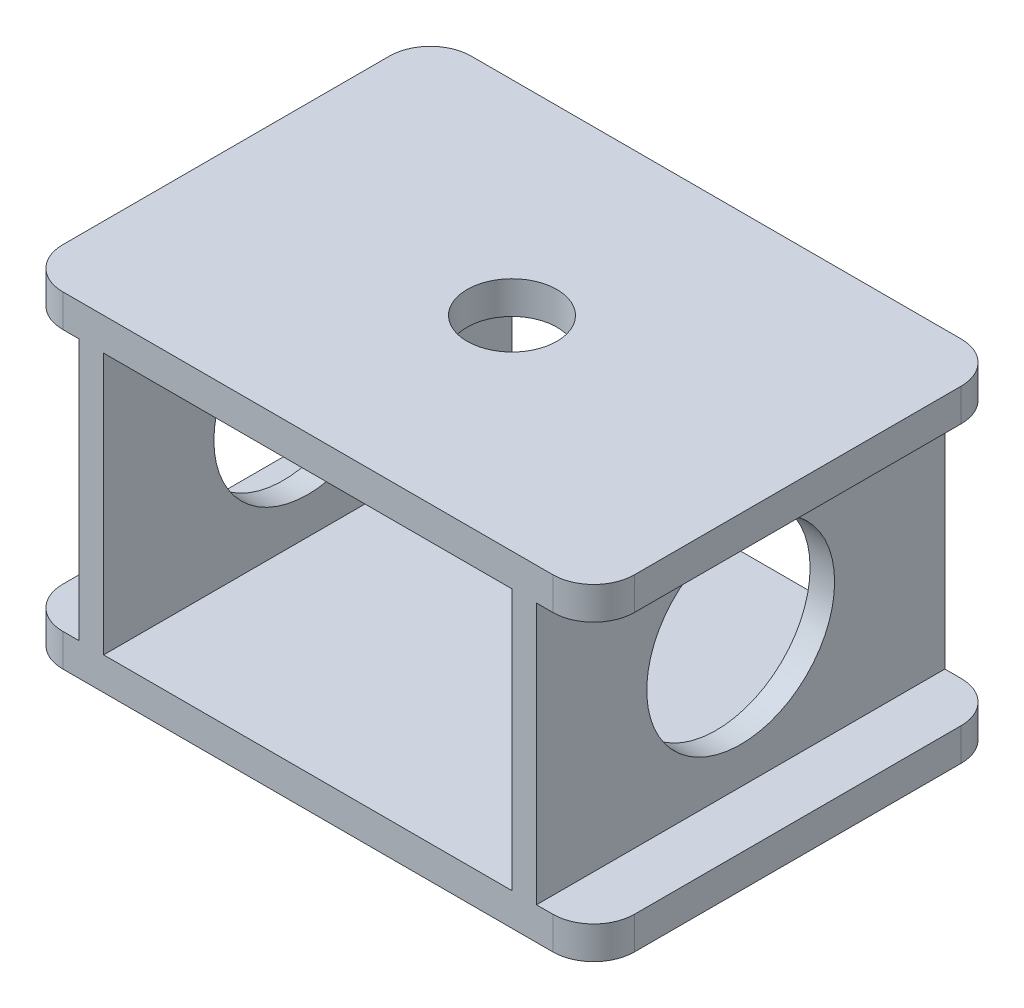
from build123d import *

# Parameters (mm, degrees)
BOSS_EXTRUDE1_DEPTH = 4
SKETCH2_W           = 3
SKETCH2_H           = 50
BOSS_EXTRUDE2_DEPTH = 32
BOSS_EXTRUDE3_DEPTH = 4
SKETCH4_R           = 11.5
CUT_EXTRUDE1_DEPTH  = 79.70196948
CUT_EXTRUDE2_REACH  = 60.737
SKETCH5_R           = 5.5


with BuildPart() as part:
    # Sketch1 → Boss-Extrude1 (new body)
    with BuildSketch(Plane(origin=(0, 0, 0), x_dir=(1, 0, 0), z_dir=(0, 1, 0))):
        with BuildLine():
            Line((-30, 25), (30, 25))
            ThreePointArc((30, 25), (33.535533906, 23.535533906), (35, 20))
            Line((35, 20), (35, -20))
            ThreePointArc((35, -20), (33.535533906, -23.535533906), (30, -25))
            Line((30, -25), (-30, -25))
            ThreePointArc((-30, -25), (-33.535533906, -23.535533906), (-35, -20))
            Line((-35, -20), (-35, 20))
            ThreePointArc((-35, 20), (-33.535533906, 23.535533906), (-30, 25))
        make_face()
    extrude(amount=BOSS_EXTRUDE1_DEPTH)

    # Sketch2 → Boss-Extrude2 (add)
    with BuildSketch(Plane(origin=(0, 4, 0), x_dir=(1, 0, 0), z_dir=(0, 1, 0))):
        with Locations((-26.5, 0)):
            Rectangle(SKETCH2_W, SKETCH2_H)
        with Locations((26.5, 0)):
            Rectangle(SKETCH2_W, SKETCH2_H)
    extrude(amount=BOSS_EXTRUDE2_DEPTH)

    # Sketch3 → Boss-Extrude3 (add)
    with BuildSketch(Plane(origin=(0, 36, 0), x_dir=(1, 0, 0), z_dir=(0, 1, 0))):
        with BuildLine():
            Line((28, -25), (30, -25))
            ThreePointArc((30, -25), (33.535533906, -23.535533906), (35, -20))
            Line((35, -20), (35, 20))
            ThreePointArc((35, 20), (33.535533906, 23.535533906), (30, 25))
            Line((30, 25), (28, 25))
            Line((28, 25), (25, 25))
            Line((25, 25), (-25, 25))
            Line((-25, 25), (-28, 25))
            Line((-28, 25), (-30, 25))
            ThreePointArc((-30, 25), (-33.535533906, 23.535533906), (-35, 20))
            Line((-35, 20), (-35, -20))
            ThreePointArc((-35, -20), (-33.535533906, -23.535533906), (-30, -25))
            Line((-30, -25), (-28, -25))
            Line((-28, -25), (-25, -25))
            Line((-25, -25), (25, -25))
            Line((25, -25), (28, -25))
        make_face()
    extrude(amount=BOSS_EXTRUDE3_DEPTH)

    # Sketch4 → Cut-Extrude1 (cut, through all)
    with BuildSketch(Plane(origin=(28, 0, 0), x_dir=(0, 0, -1), z_dir=(1, 0, 0))):
        with Locations((0, 20)):
            Circle(SKETCH4_R)
    extrude(amount=-CUT_EXTRUDE1_DEPTH, mode=Mode.SUBTRACT)

    # Sketch5 → Cut-Extrude2 (cut, up to next)
    with BuildSketch(Plane(origin=(0, 40, 0), x_dir=(1, 0, 0), z_dir=(0, 1, 0)), mode=Mode.PRIVATE) as cut_extrude2_sk1:
        with Locations(Location((0, 0, 0), (0, 0, 270))):
            Circle(SKETCH5_R)
    cut_extrude2_tool1 = extrude(cut_extrude2_sk1.sketch, amount=-CUT_EXTRUDE2_REACH, mode=Mode.PRIVATE) & part.part
    add(cut_extrude2_tool1.solids().sort_by_distance((0, 40, 0))[0], mode=Mode.SUBTRACT)


solid = part.part
